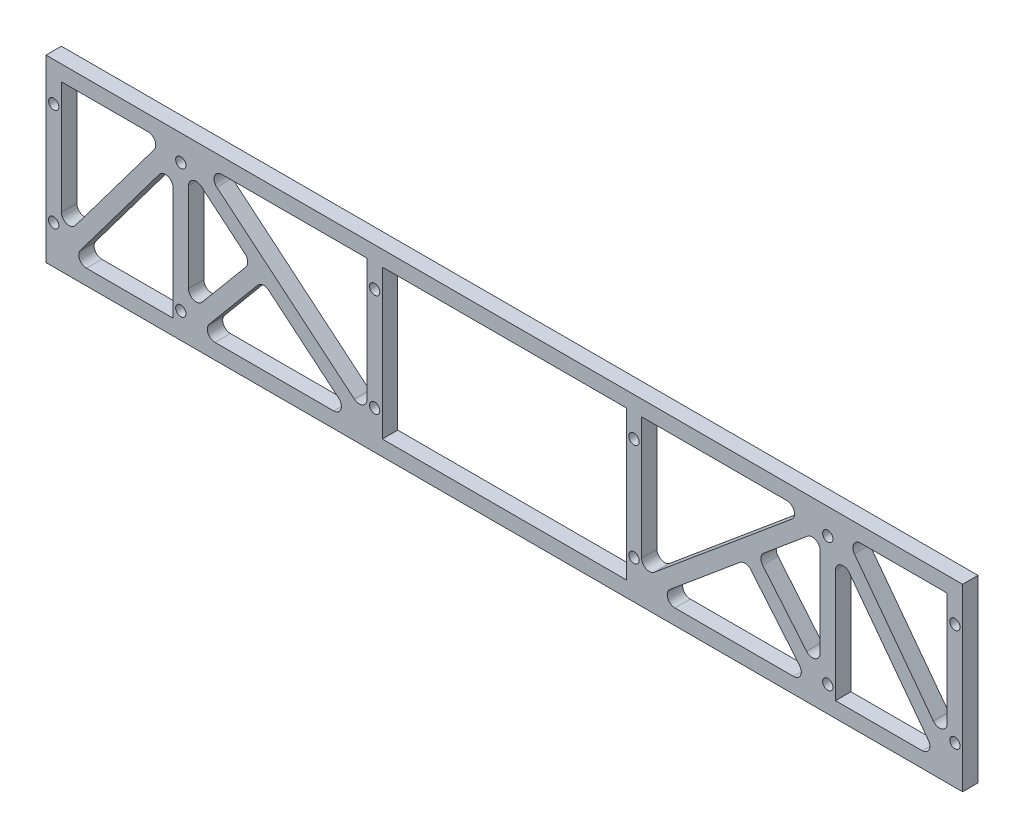
from build123d import *

# Parameters (mm, degrees)
SKETCH_2_W          = 357
SKETCH_2_H          = 70
SKETCH_2_W_2        = 345
SKETCH_2_H_2        = 58
EXTRUDE_1_DEPTH     = 6
SKETCH_3_W          = 6
SKETCH_3_H          = 58
EXTRUDE_2_DEPTH     = 6
EXTRUDE_3_DEPTH     = 6
FILLET_1_R          = 3
SKETCH_5_W          = 6
SKETCH_5_H          = 58
EXTRUDE_4_DEPTH     = 6
EXTRUDE_5_DEPTH     = 6
FILLET_2_R          = 3
SKETCH_7_R          = 2
CUT_EXTRUDE_1_DEPTH = 6


with BuildPart() as part:
    # 草图2 → 凸台-拉伸1 (new body)
    with BuildSketch(Plane.XY):
        Rectangle(SKETCH_2_W, SKETCH_2_H)
        Rectangle(SKETCH_2_W_2, SKETCH_2_H_2, mode=Mode.SUBTRACT)
    extrude(amount=EXTRUDE_1_DEPTH)

    # 草图3 → 凸台-拉伸2 (add)
    with BuildSketch(Plane.XY):
        with Locations((-126, 0)):
            Rectangle(SKETCH_3_W, SKETCH_3_H)
        with Locations((126, 0)):
            Rectangle(SKETCH_3_W, SKETCH_3_H)
    extrude(amount=EXTRUDE_2_DEPTH)

    # 草图4 → 凸台-拉伸3 (add)
    with BuildSketch(Plane.XY):
        Polygon((-172.5, -29), (-172.5, -24), (-132.75, 29), (-129, 29), (-129, 24), (-168.75, -29), align=None)
        Polygon((129, 24), (168.75, -29), (172.5, -29), (172.5, -24), (132.75, 29), (129, 29), align=None)
    extrude(amount=EXTRUDE_3_DEPTH)

    # 圆角1
    fillet_1_edges = [part.edges().sort_by_distance(p)[0] for p in [
        (-168.75, -29, 3),
        (-129, 24, 3),
        (-132.75, 29, 3),
        (-172.5, -24, 3),
        (129, 24, 3),
        (168.75, -29, 3),
        (172.5, -24, 3),
        (132.75, 29, 3),
    ]]
    fillet(fillet_1_edges, radius=FILLET_1_R)

    # 草图5 → 凸台-拉伸4 (add)
    with BuildSketch(Plane.XY):
        with Locations((50.5, 0)):
            Rectangle(SKETCH_5_W, SKETCH_5_H)
        with Locations((-50.5, 0)):
            Rectangle(SKETCH_5_W, SKETCH_5_H)
    extrude(amount=EXTRUDE_4_DEPTH)

    # 草图6 → 凸台-拉伸5 (add)
    with BuildSketch(Plane.XY):
        Polygon((123, 29), (123, 25.092571363), (98.693529244, 4.808034617), (123, -24.317822582), (123, -29), (119.092571363, -29), (94.086919201, 0.963669401), (58.182177418, -29), (53.5, -29), (53.5, -25.092571363), (118.317822582, 29), align=None)
        Polygon((-119.092571363, -29), (-94.086919201, 0.963669401), (-58.182177418, -29), (-53.5, -29), (-53.5, -25.092571363), (-118.317822582, 29), (-123, 29), (-123, 25.092571363), (-98.693529244, 4.808034617), (-123, -24.317822582), (-123, -29), align=None)
    extrude(amount=EXTRUDE_5_DEPTH)

    # 圆角2
    fillet_2_edges = [part.edges().sort_by_distance(p)[0] for p in [
        (118.317822582, 29, 3),
        (53.5, -25.092571363, 3),
        (58.182177418, -29, 3),
        (94.086919201, 0.963669401, 3),
        (119.092571363, -29, 3),
        (123, -24.317822582, 3),
        (98.693529244, 4.808034617, 3),
        (123, 25.092571363, 3),
        (-119.092571363, -29, 3),
        (-94.086919201, 0.963669401, 3),
        (-58.182177418, -29, 3),
        (-53.5, -25.092571363, 3),
        (-118.317822582, 29, 3),
        (-123, 25.092571363, 3),
        (-98.693529244, 4.808034617, 3),
        (-123, -24.317822582, 3),
    ]]
    fillet(fillet_2_edges, radius=FILLET_2_R)

    # 草图7 → 切除-拉伸1 (cut)
    with BuildSketch(Plane(origin=(0, 0, 0), x_dir=(-1, 0, 0), z_dir=(0, 0, -1))):
        with Locations((175.5, 20)):
            Circle(SKETCH_7_R)
        with Locations((175.5, -20)):
            Circle(SKETCH_7_R)
        with Locations((50.5, 20)):
            Circle(SKETCH_7_R)
        with Locations((50.5, -20)):
            Circle(SKETCH_7_R)
        with Locations(Location((-175.5, -20, 0), (0, 0, 180))):
            Circle(SKETCH_7_R)
        with Locations(Location((-175.5, 20, 0), (0, 0, 180))):
            Circle(SKETCH_7_R)
        with Locations(Location((-50.5, -20, 0), (0, 0, 180))):
            Circle(SKETCH_7_R)
        with Locations(Location((-50.5, 20, 0), (0, 0, 180))):
            Circle(SKETCH_7_R)
        with Locations((126, 25)):
            Circle(SKETCH_7_R)
        with Locations((126, -25)):
            Circle(SKETCH_7_R)
        with Locations(Location((-126, -25, 0), (0, 0, 180))):
            Circle(SKETCH_7_R)
        with Locations(Location((-126, 25, 0), (0, 0, 180))):
            Circle(SKETCH_7_R)
    extrude(amount=-CUT_EXTRUDE_1_DEPTH, mode=Mode.SUBTRACT)


solid = part.part
